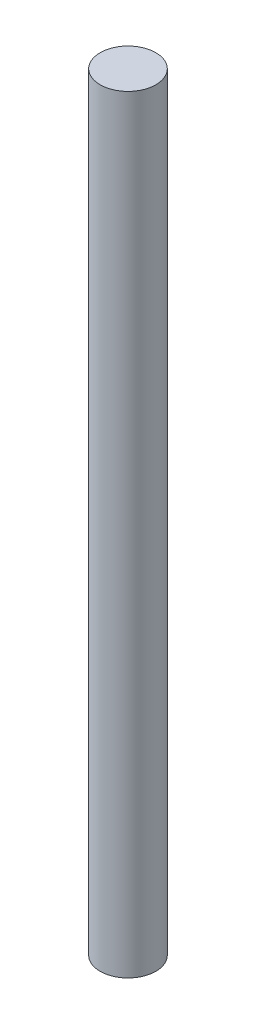
from build123d import *

# Parameters (mm, degrees)
SKETCH_1_R      = 5
EXTRUDE_1_DEPTH = 138


with BuildPart() as part:
    # 草图1 → 凸台-拉伸1 (new body)
    with BuildSketch(Plane(origin=(0, 0, 0), x_dir=(1, 0, 0), z_dir=(0, 1, 0))):
        with Locations(Location((0, 0, 0), (0, 0, 270))):
            Circle(SKETCH_1_R)
    extrude(amount=EXTRUDE_1_DEPTH)


solid = part.part
